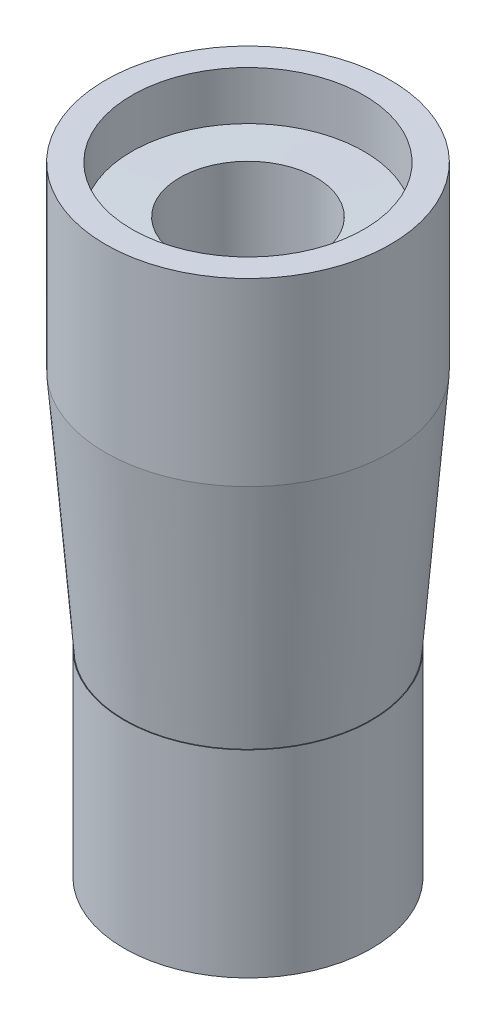
from build123d import *


with BuildPart() as part:
    # Sketch1 → Revolve1 (revolve)
    with BuildSketch(Plane.XY, mode=Mode.PRIVATE) as revolve1_sk:
        Polygon((-21.738699739, -13.07516129), (-21.738699739, -16.987325897), (-24.199594923, -16.987325897), (-24.199594923, -1.987321203), (-24.149594923, -1.987321203), (-25.61209695, 16.326317755), (-25.61209695, 26.326317755), (-25.61209695, 30.016317755), (-23.61209695, 30.016317755), (-23.61209695, 26.326317755), (-19.97209695, 26.42483871), (-19.97209695, -13.07516129), align=None)
    revolve(revolve1_sk.sketch.rotate(Axis((-14.79709695, 26.42483871, 0), (0, -1, 0)), 270), axis=Axis((-14.79709695, 26.42483871, 0), (0, -1, 0)))


solid = part.part
